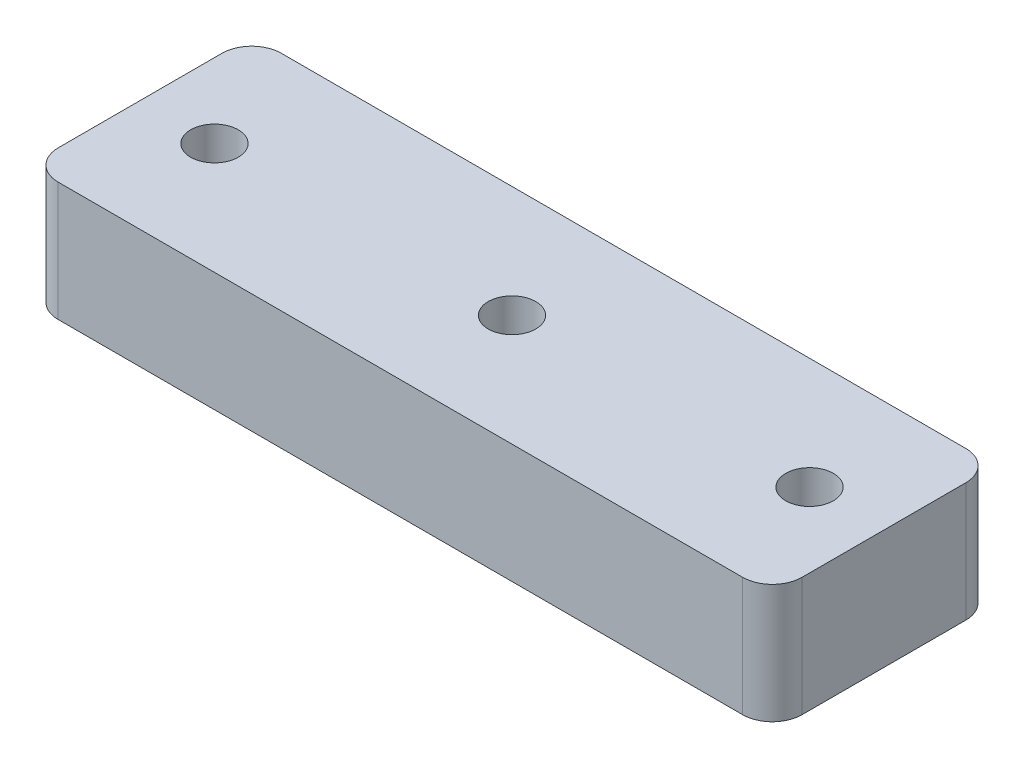
from build123d import *

# Parameters (mm, degrees)
SKETCH_1_W      = 50
SKETCH_1_H      = 15
SKETCH_1_R      = 1.6
EXTRUDE_1_DEPTH = 8
FILLET_1_R      = 2


with BuildPart() as part:
    # 草图1 → 凸台-拉伸1 (new body)
    with BuildSketch(Plane(origin=(0, 0, 0), x_dir=(1, 0, 0), z_dir=(0, 1, 0))):
        Rectangle(SKETCH_1_W, SKETCH_1_H)
        with Locations(Location((-20, 0, 0), (0, 0, 270))):
            Circle(SKETCH_1_R, mode=Mode.SUBTRACT)
        with Locations(Location((0, 0, 0), (0, 0, 270))):
            Circle(SKETCH_1_R, mode=Mode.SUBTRACT)
        with Locations(Location((20, 0, 0), (0, 0, 270))):
            Circle(SKETCH_1_R, mode=Mode.SUBTRACT)
    extrude(amount=EXTRUDE_1_DEPTH)

    # 圆角1
    fillet_1_edges = [part.edges().sort_by_distance(p)[0] for p in [
        (25, 4, 7.5),
        (-25, 4, 7.5),
        (-25, 4, -7.5),
        (25, 4, -7.5),
    ]]
    fillet(fillet_1_edges, radius=FILLET_1_R)


solid = part.part
